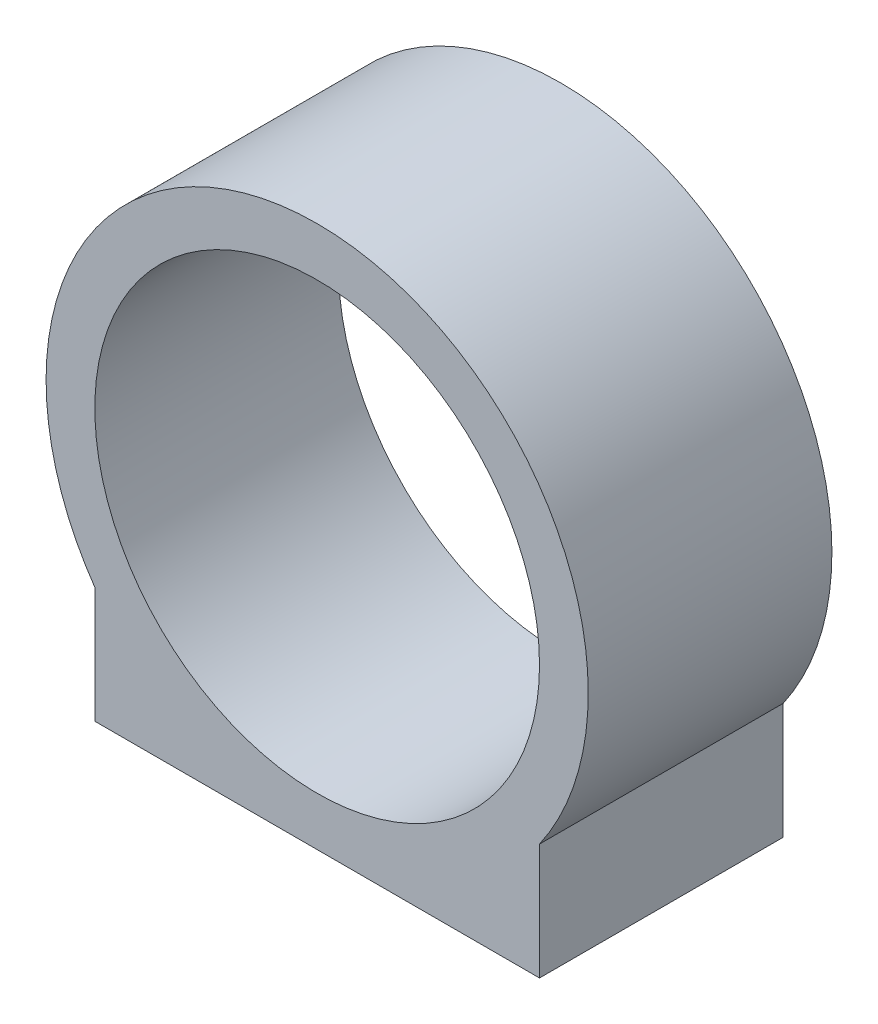
from build123d import *

# Parameters (mm, degrees)
SKETCH1_R           = 11.125
SKETCH1_R_2         = 9.125
BOSS_EXTRUDE1_DEPTH = 10
BOSS_EXTRUDE2_START = -10
BOSS_EXTRUDE2_DEPTH = 10


with BuildPart() as part:
    # Sketch1 → Boss-Extrude1 (new body)
    with BuildSketch(Plane.XY):
        Circle(SKETCH1_R)
        Circle(SKETCH1_R_2, mode=Mode.SUBTRACT)
    extrude(amount=BOSS_EXTRUDE1_DEPTH)

    # Sketch2 → Boss-Extrude2 (add)
    with BuildSketch(Plane.XY.offset(10).offset(BOSS_EXTRUDE2_START)):
        with BuildLine():
            Line((-9.125, -9.125), (-6.363961031, -9.125))
            ThreePointArc((-6.363961031, -9.125), (-7.866562941, -7.866562941), (-9.125, -6.363961031))
            Line((-9.125, -6.363961031), (-9.125, -9.125))
        make_face()
        with BuildLine():
            Line((-9.125, -11.125), (0, -11.125))
            ThreePointArc((0, -11.125), (-3.335416016, -10.613228774), (-6.363961031, -9.125))
            Line((-6.363961031, -9.125), (-9.125, -9.125))
            Line((-9.125, -9.125), (-9.125, -11.125))
        make_face()
        with BuildLine():
            Line((0, -11.125), (9.125, -11.125))
            Line((9.125, -11.125), (9.125, -9.125))
            Line((9.125, -9.125), (6.363961031, -9.125))
            ThreePointArc((6.363961031, -9.125), (3.335416016, -10.613228774), (0, -11.125))
        make_face()
        with BuildLine():
            Line((6.363961031, -9.125), (9.125, -9.125))
            Line((9.125, -9.125), (9.125, -6.363961031))
            ThreePointArc((9.125, -6.363961031), (7.866562941, -7.866562941), (6.363961031, -9.125))
        make_face()
    extrude(amount=BOSS_EXTRUDE2_DEPTH)


solid = part.part
